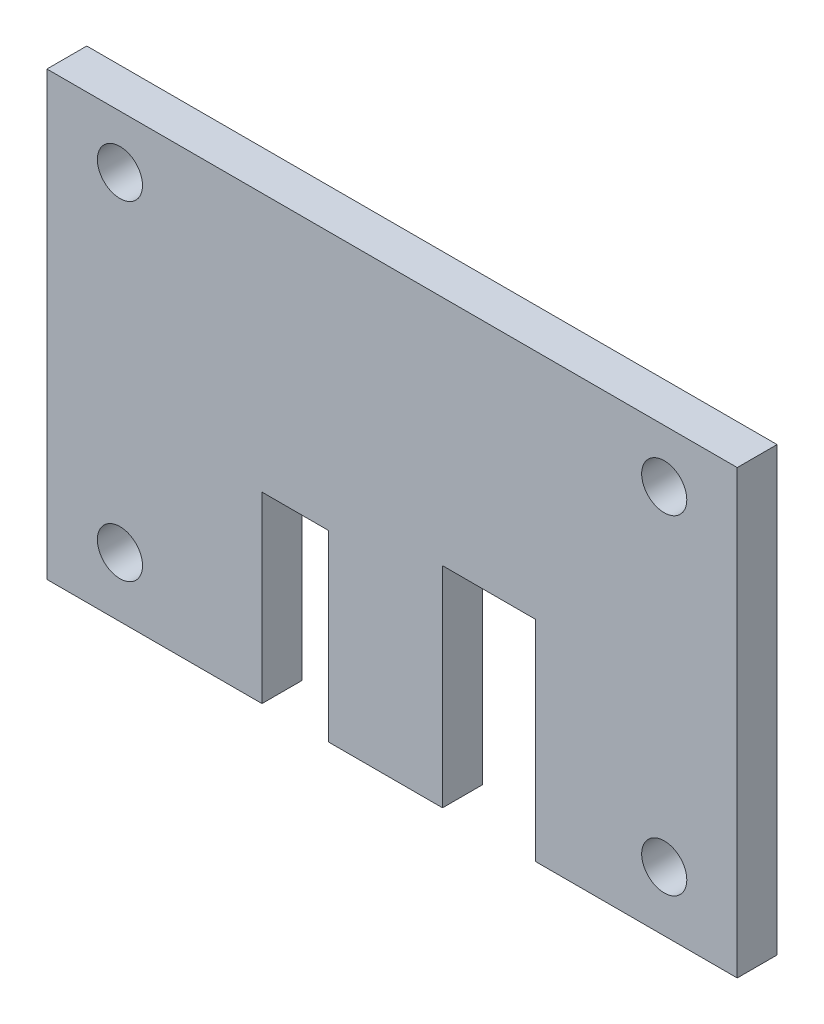
from build123d import *

# Parameters (mm, degrees)
SKETCH1_W           = 52
SKETCH1_H           = 33.3
COVER_PLATE_DEPTH   = 3
SKETCH2_W           = 5
SKETCH2_H           = 14.8
SKETCH2_W_2         = 7
SKETCH2_H_2         = 16.8
CABLE_NOTCHES_DEPTH = 5
SKETCH3_R           = 1.7
SCREW_HOLES_DEPTH   = 5


with BuildPart() as part:
    # Sketch1 → Cover Plate (new body)
    with BuildSketch(Plane.XY.offset(124.4)):
        with Locations((-36.5, -10.15)):
            Rectangle(SKETCH1_W, SKETCH1_H)
    extrude(amount=COVER_PLATE_DEPTH)

    # Sketch2 → Cable Notches (cut)
    with BuildSketch(Plane.XY.offset(123.4)):
        with Locations((-43.8, -20.4)):
            Rectangle(SKETCH2_W, SKETCH2_H)
        with Locations((-29.2, -19.4)):
            Rectangle(SKETCH2_W_2, SKETCH2_H_2)
    extrude(amount=CABLE_NOTCHES_DEPTH, mode=Mode.SUBTRACT)

    # Sketch3 → Screw Holes (cut)
    with BuildSketch(Plane.XY.offset(123.4)):
        with Locations((-57, -22.3)):
            Circle(SKETCH3_R)
        with Locations((-57, 2.5)):
            Circle(SKETCH3_R)
        with Locations((-16, -22.3)):
            Circle(SKETCH3_R)
        with Locations((-16, 2.5)):
            Circle(SKETCH3_R)
    extrude(amount=SCREW_HOLES_DEPTH, mode=Mode.SUBTRACT)


solid = part.part
